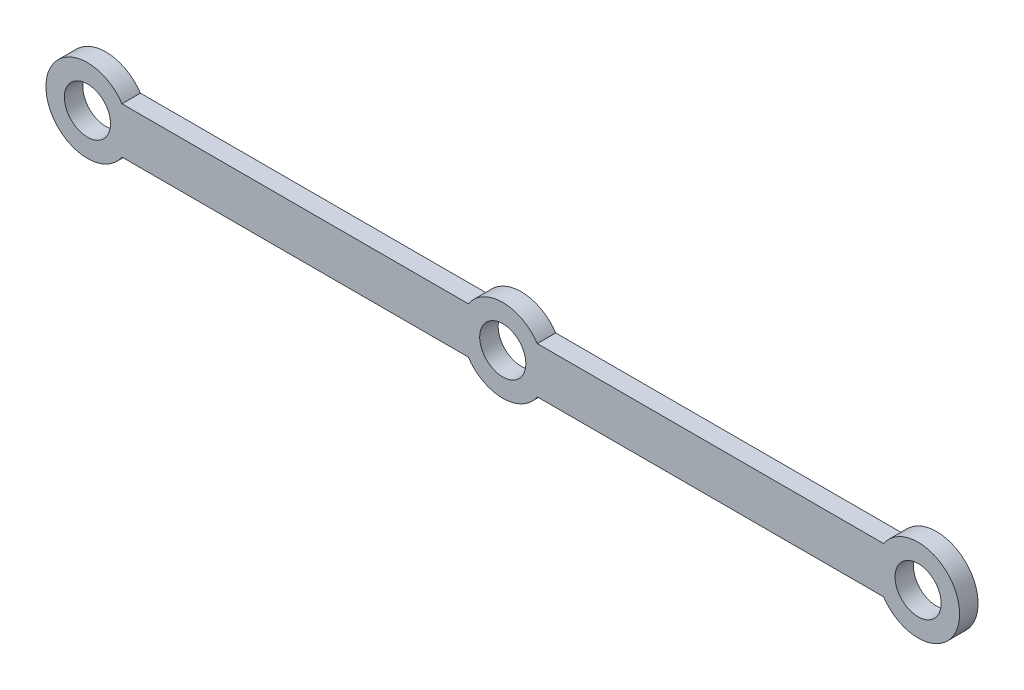
from build123d import *

# Parameters (mm, degrees)
SKETCH3_R           = 2.5
BOSS_EXTRUDE2_DEPTH = 1


with BuildPart() as part:
    # Sketch3 → Boss-Extrude2 (new, symmetric)
    with BuildSketch(Plane.XY):
        with BuildLine():
            Line((-41.258342613, 2.5), (-3.741657387, 2.5))
            ThreePointArc((-3.741657387, 2.5), (0, 4.5), (3.741657387, 2.5))
            Line((3.741657387, 2.5), (41.258342613, 2.5))
            ThreePointArc((41.258342613, 2.5), (49.5, 0), (41.258342613, -2.5))
            Line((41.258342613, -2.5), (3.741657387, -2.5))
            ThreePointArc((3.741657387, -2.5), (0, -4.5), (-3.741657387, -2.5))
            Line((-3.741657387, -2.5), (-41.258342613, -2.5))
            ThreePointArc((-41.258342613, -2.5), (-49.5, 0), (-41.258342613, 2.5))
        make_face()
        with Locations((-45, 0)):
            Circle(SKETCH3_R, mode=Mode.SUBTRACT)
        Circle(SKETCH3_R, mode=Mode.SUBTRACT)
        with Locations((45, 0)):
            Circle(SKETCH3_R, mode=Mode.SUBTRACT)
    extrude(amount=BOSS_EXTRUDE2_DEPTH, both=True)


solid = part.part
